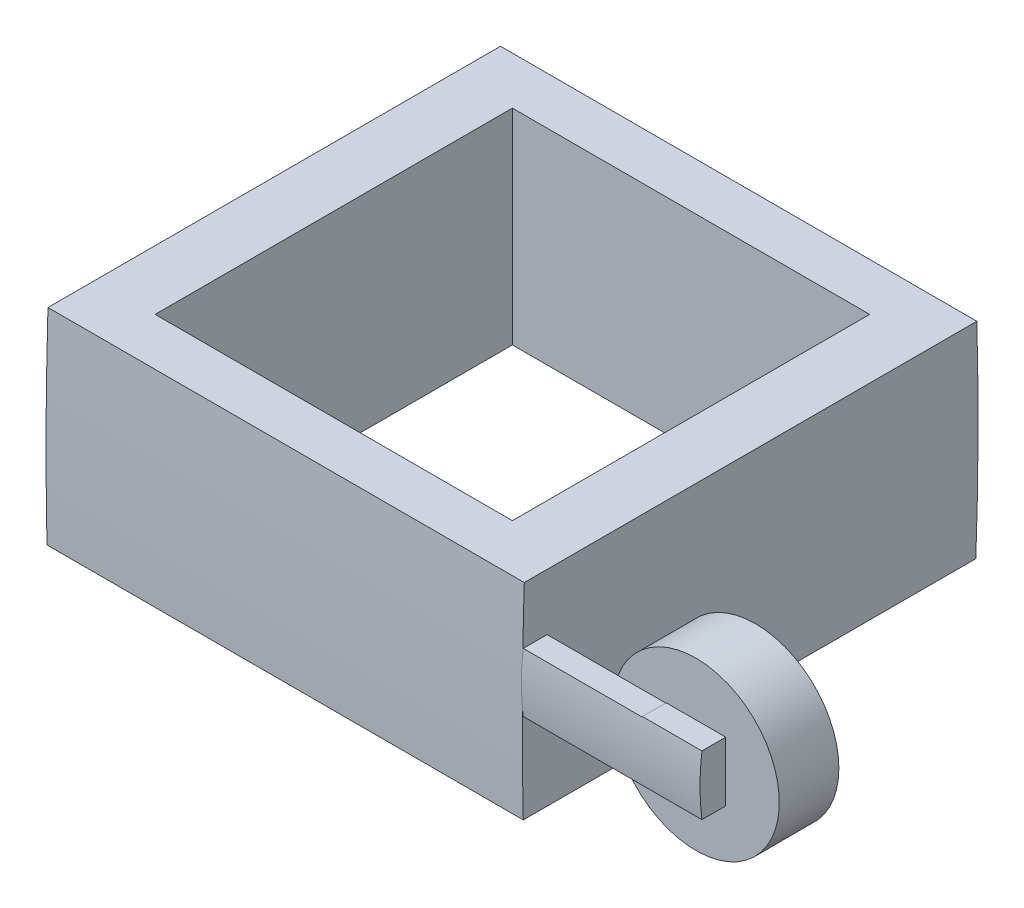
from build123d import *

# Parameters (mm, degrees)
SKETCH1_R           = 14
BOSS_EXTRUDE1_DEPTH = 10
SKETCH2_R           = 2.25
CUT_EXTRUDE1_DEPTH  = 5
SKETCH3_R           = 5
CUT_EXTRUDE2_DEPTH  = 1.8
SKETCH4_W           = 10
SKETCH4_H           = 10
BOSS_EXTRUDE2_DEPTH = 8
SKETCH6_W           = 8
SKETCH6_H           = 9.912865289
BOSS_EXTRUDE3_DEPTH = 20
CUT_EXTRUDE3_DEPTH  = 30
BOSS_EXTRUDE4_DEPTH = 80
SKETCH9_W           = 60
SKETCH9_H           = 60
CUT_EXTRUDE4_DEPTH  = 100


with BuildPart() as part:
    # Sketch1 → Boss-Extrude1 (new body)
    with BuildSketch(Plane.XY):
        Circle(SKETCH1_R)
    extrude(amount=BOSS_EXTRUDE1_DEPTH)

    # Sketch2 → Cut-Extrude1 (cut)
    with BuildSketch(Plane(origin=(0, 0, 0), x_dir=(-1, 0, 0), z_dir=(0, 0, -1))):
        Circle(SKETCH2_R)
    extrude(amount=-CUT_EXTRUDE1_DEPTH, mode=Mode.SUBTRACT)

    # Sketch3 → Cut-Extrude2 (cut)
    with BuildSketch(Plane(origin=(0, 0, 0), x_dir=(-1, 0, 0), z_dir=(0, 0, -1))):
        Circle(SKETCH3_R)
    extrude(amount=-CUT_EXTRUDE2_DEPTH, mode=Mode.SUBTRACT)

    # Sketch4 → Boss-Extrude2 (add)
    with BuildSketch(Plane.XY.offset(10)):
        Rectangle(SKETCH4_W, SKETCH4_H)
    extrude(amount=BOSS_EXTRUDE2_DEPTH)

    # Sketch6 → Boss-Extrude3 (add)
    with BuildSketch(Plane.ZY.offset(5)):
        with Locations((14, -0.043567356)):
            Rectangle(SKETCH6_W, SKETCH6_H)
    extrude(amount=BOSS_EXTRUDE3_DEPTH)

    # Sketch7 → Cut-Extrude3 (cut)
    with BuildSketch(Plane(origin=(5, 0, 0), x_dir=(0, 0, -1), z_dir=(1, 0, 0))):
        with BuildLine():
            Line((-18, 5), (-18, -5))
            Line((-18, -5), (-14, -5))
            ThreePointArc((-14, -5), (-14.330383596, 0), (-14, 5))
            Line((-14, 5), (-18, 5))
        make_face()
    extrude(amount=-CUT_EXTRUDE3_DEPTH, mode=Mode.SUBTRACT)

    # Sketch8 → Boss-Extrude4 (add)
    with BuildSketch(Plane.ZY.offset(25)):
        with BuildLine():
            Line((-62.16885098, 14.403585903), (13.83114902, 14.403585903))
            ThreePointArc((13.83114902, 14.403585903), (14.156322075, -2.818810644), (14, -20.043567356))
            Line((14, -20.043567356), (-62, -20.043567356))
            ThreePointArc((-62, -20.043567356), (-62.363996537, -2.821361111), (-62.16885098, 14.403585903))
        make_face()
    extrude(amount=BOSS_EXTRUDE4_DEPTH)

    # Sketch9 → Cut-Extrude4 (cut)
    with BuildSketch(Plane(origin=(0, 14.403585903, 0), x_dir=(1, 0, 0), z_dir=(0, 1, 0))):
        with Locations((-65, 24.16885098)):
            Rectangle(SKETCH9_W, SKETCH9_H)
    extrude(amount=-CUT_EXTRUDE4_DEPTH, mode=Mode.SUBTRACT)


solid = part.part
